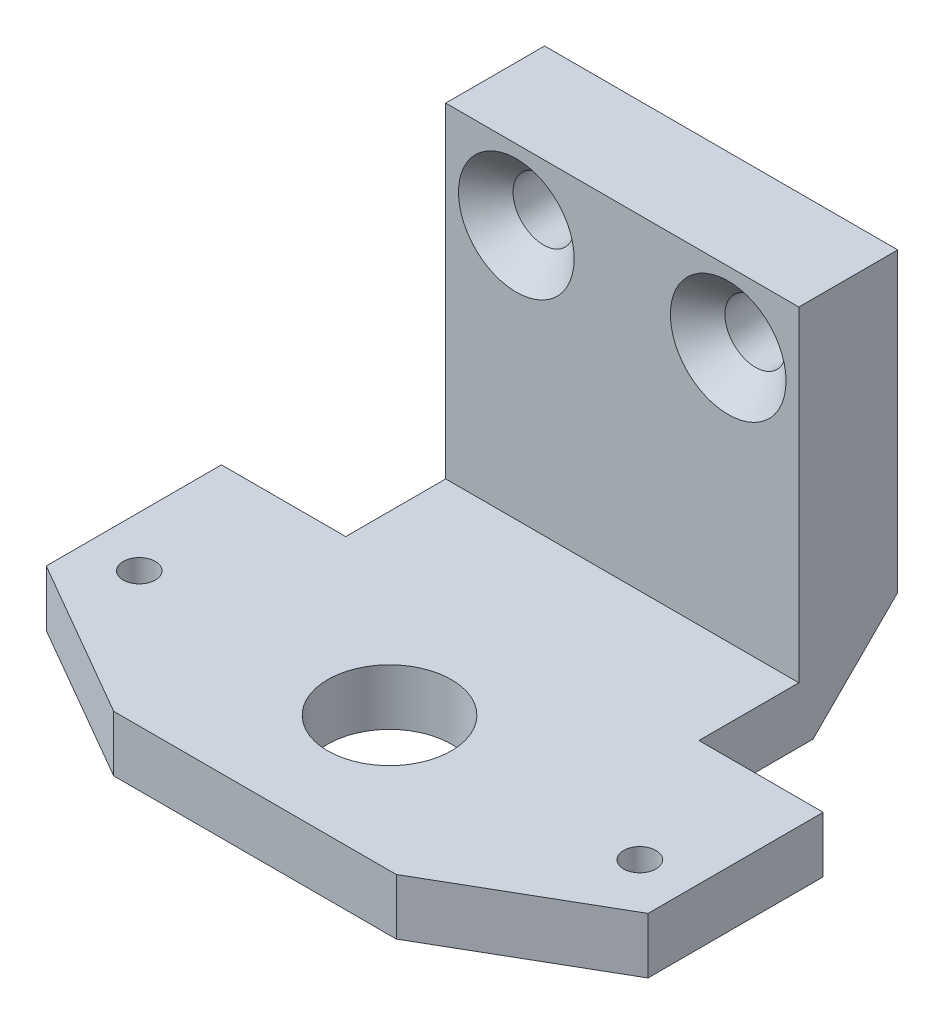
from build123d import *

# Parameters (mm, degrees)
BOSS_EXTRUDE1_DEPTH                             = 5.0292
SKETCH2_W                                       = 31.75
SKETCH2_H                                       = 8.89
BOSS_EXTRUDE2_DEPTH                             = 34.29
CUT_EXTRUDE1_DEPTH                              = 61.675621628
CUT_EXTRUDE1_DEPTH_BACK                         = 61.675621628
CSK_FOR_M5_FLAT_HEAD_MACHINE_SCREW1_D           = 5.5
CSK_FOR_M5_FLAT_HEAD_MACHINE_SCREW1_CSINK_D     = 10.4
CSK_FOR_M5_FLAT_HEAD_MACHINE_SCREW1_CSINK_ANGLE = 90
SKETCH7_R                                       = 5.55625
CUT_EXTRUDE2_DEPTH                              = 48.445089331
M2_5_CLEARANCE_HOLE1_D                          = 2.9


with BuildPart() as part:
    # Sketch1 → Boss-Extrude1 (new body)
    with BuildSketch(Plane(origin=(0, 0, 0), x_dir=(1, 0, 0), z_dir=(0, 1, 0))):
        Polygon((-27.051, 7.874), (-15.875, 7.874), (-15.875, 16.860446287), (15.875, 16.860446287), (15.875, 7.874), (27.051, 7.874), (27.051, -7.874), (12.7, -16.159553713), (-12.7, -16.159553713), (-27.051, -7.874), align=None)
    extrude(amount=BOSS_EXTRUDE1_DEPTH)

    # Sketch2 → Boss-Extrude2 (add)
    with BuildSketch(Plane(origin=(0, 0, 0), x_dir=(1, 0, 0), z_dir=(0, 1, 0))):
        with Locations((0, 21.305446287)):
            Rectangle(SKETCH2_W, SKETCH2_H)
    extrude(amount=BOSS_EXTRUDE2_DEPTH)

    # Sketch3 → Cut-Extrude1 (cut, two sides: drawn at the far end of the back side and taken through both)
    with BuildSketch(Plane(origin=(15.875, 0, 0), x_dir=(0, 0, -1), z_dir=(1, 0, 0)).offset(-CUT_EXTRUDE1_DEPTH_BACK)):
        Polygon((103.074442863, 84.943996576), (25.750446287, 7.62), (18.130446287, 0), (-59.19355029, -77.323996576), (95.454442863, -231.971989729), (257.722436016, -69.703996576), align=None)
    extrude(amount=CUT_EXTRUDE1_DEPTH + CUT_EXTRUDE1_DEPTH_BACK, mode=Mode.SUBTRACT)

    # CSK for M5 Flat Head Machine Screw1 (through all)
    with Locations(Plane.XY.offset(-16.860446287)):
        with Locations((-9.525, 27.94), (9.525, 27.94)):
            CounterSinkHole(CSK_FOR_M5_FLAT_HEAD_MACHINE_SCREW1_D / 2, CSK_FOR_M5_FLAT_HEAD_MACHINE_SCREW1_CSINK_D / 2, counter_sink_angle=CSK_FOR_M5_FLAT_HEAD_MACHINE_SCREW1_CSINK_ANGLE)

    # Sketch7 → Cut-Extrude2 (cut, through all)
    with BuildSketch(Plane(origin=(0, 5.0292, 0), x_dir=(1, 0, 0), z_dir=(0, 1, 0))):
        with Locations(Location((0, -4.064, 0), (0, 0, 270))):
            Circle(SKETCH7_R)
    extrude(amount=-CUT_EXTRUDE2_DEPTH, mode=Mode.SUBTRACT)

    # M2.5 Clearance Hole1 (through all)
    with Locations(Plane(origin=(0, 5.0292, 0), x_dir=(1, 0, 0), z_dir=(0, 1, 0))):
        with Locations((-22.5, -4.064), (22.5, -4.064)):
            Hole(M2_5_CLEARANCE_HOLE1_D / 2)


solid = part.part
